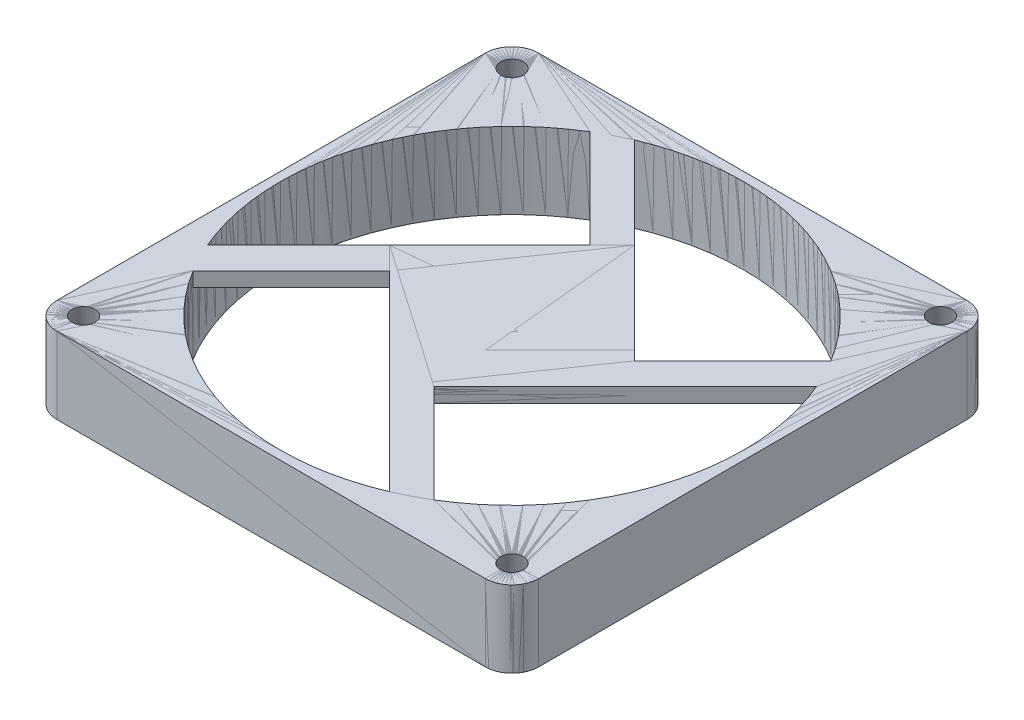
from build123d import *

# Parameters (mm, degrees)
SKETCH1_W           = 92
SKETCH1_H           = 91.948
BOSS_EXTRUDE1_DEPTH = 14.605
SKETCH2_R           = 44.323
CUT_EXTRUDE1_DEPTH  = 14.605
FILLET1_R           = 5.08
SKETCH3_R           = 2.1844
CUT_EXTRUDE2_DEPTH  = 14.605
BOSS_EXTRUDE2_DEPTH = 2.794
CIRPATTERN2_COUNT   = 4


with BuildPart() as part:
    # Sketch1 → Boss-Extrude1 (new body)
    with BuildSketch(Plane(origin=(0, 0, 0), x_dir=(1, 0, 0), z_dir=(0, 1, 0))):
        Rectangle(SKETCH1_W, SKETCH1_H)
    extrude(amount=BOSS_EXTRUDE1_DEPTH)

    # Sketch2 → Cut-Extrude1 (cut)
    with BuildSketch(Plane(origin=(0, 14.605, 0), x_dir=(1, 0, 0), z_dir=(0, 1, 0))):
        with Locations(Location((0, 0, 0), (0, 0, 270))):
            Circle(SKETCH2_R)
    extrude(amount=-CUT_EXTRUDE1_DEPTH, mode=Mode.SUBTRACT)

    # Fillet1
    fillet1_edges = [part.edges().sort_by_distance(p)[0] for p in [
        (46, 7.3025, 45.974),
        (-46, 7.3025, 45.974),
        (-46, 7.3025, -45.974),
        (46, 7.3025, -45.974),
    ]]
    fillet(fillet1_edges, radius=FILLET1_R)

    # Sketch3 → Cut-Extrude2 (cut)
    with BuildSketch(Plane(origin=(0, 14.605, 0), x_dir=(1, 0, 0), z_dir=(0, 1, 0))):
        with Locations(Location((40.92, -40.894, 0), (0, 0, 270))):
            Circle(SKETCH3_R)
        with Locations(Location((-40.92, -40.894, 0), (0, 0, 270))):
            Circle(SKETCH3_R)
        with Locations(Location((40.92, 40.894, 0), (0, 0, 270))):
            Circle(SKETCH3_R)
        with Locations(Location((-40.92, 40.894, 0), (0, 0, 270))):
            Circle(SKETCH3_R)
    extrude(amount=-CUT_EXTRUDE2_DEPTH, mode=Mode.SUBTRACT)

    # Sketch4 → Boss-Extrude2 (add)
    with BuildSketch(Plane(origin=(0, 14.605, 0), x_dir=(1, 0, 0), z_dir=(0, 1, 0))):
        Polygon((-22.625334085, 45.974), (-26.846054462, 41.753279623), (-4.220720377, 19.127945538), (0, 23.348665915), align=None)
        Polygon((0, 23.348665915), (-4.220720377, 19.127945538), (0, 14.907225161), align=None)
        Polygon((0, 14.907225161), (-4.220720377, 19.127945538), (-23.348665915, 0), (0, -23.348665915), align=None)
        Polygon((0, 23.348665915), (0, 14.907225161), (5.871754603, 9.035470558), (10.09247498, 13.256190935), align=None)
        Polygon((5.871754603, 9.035470558), (0, 14.907225161), (0, -23.348665915), (23.348665915, 0), (10.09247498, 13.256190935), align=None)
    extrude(amount=-BOSS_EXTRUDE2_DEPTH)


with BuildPart() as cirpattern2_1:
    # CirPattern2: pattern copy
    add(part.part.rotate(Axis((0, 0, 0), (0, 1, 0)), 1 * 360 / CIRPATTERN2_COUNT))


with BuildPart() as cirpattern2_2:
    # CirPattern2: pattern copy
    add(part.part.rotate(Axis((0, 0, 0), (0, 1, 0)), 2 * 360 / CIRPATTERN2_COUNT))


with BuildPart() as cirpattern2_3:
    # CirPattern2: pattern copy
    add(part.part.rotate(Axis((0, 0, 0), (0, 1, 0)), 3 * 360 / CIRPATTERN2_COUNT))


solid = Compound([part.part, cirpattern2_1.part, cirpattern2_2.part, cirpattern2_3.part])
